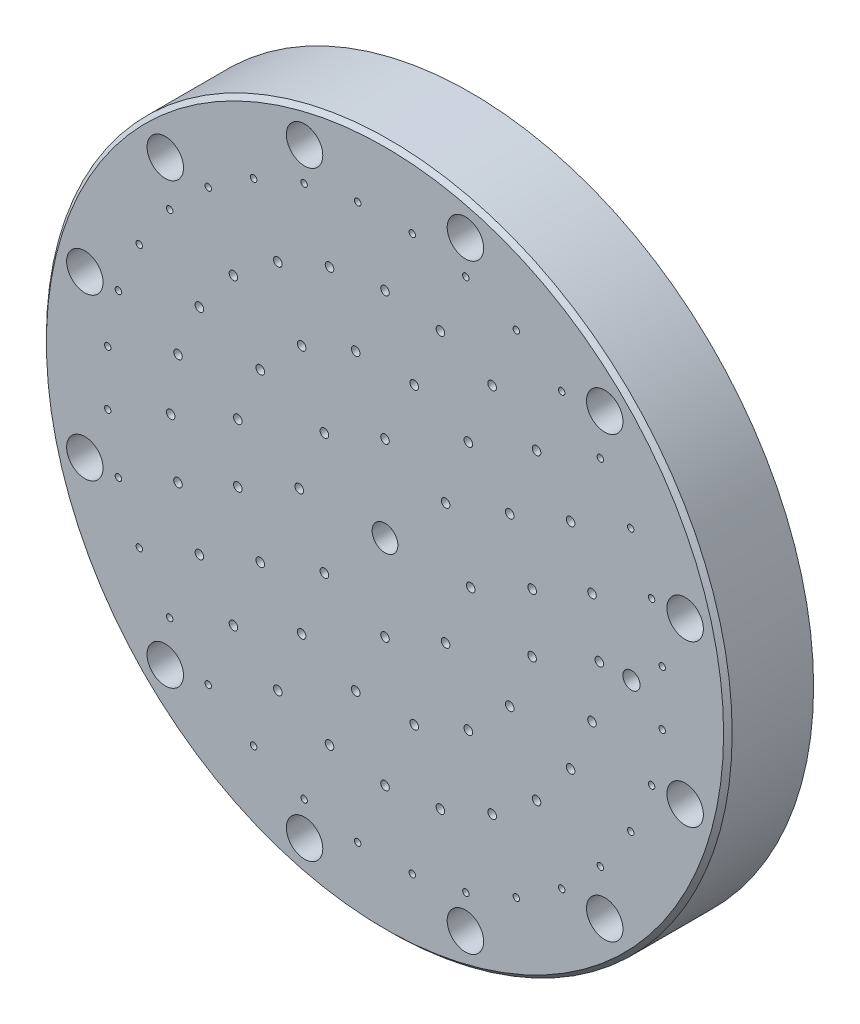
from build123d import *

# Parameters (mm, degrees)
SKETCH_1_R           = 80
EXTRUDE_1_DEPTH      = 20
SKETCH_2_R           = 23
SKETCH_2_R_2         = 17
CUT_EXTRUDE_1_DEPTH  = 8
SKETCH_3_R           = 38
SKETCH_3_R_2         = 32
CUT_EXTRUDE_2_DEPTH  = 8
SKETCH_4_R           = 53
SKETCH_4_R_2         = 47
CUT_EXTRUDE_3_DEPTH  = 8
SKETCH_5_R           = 68
SKETCH_5_R_2         = 62
CUT_EXTRUDE_4_DEPTH  = 8
SKETCH_6_R           = 1
CUT_EXTRUDE_5_DEPTH  = 12
SKETCH_7_R           = 1
CUT_EXTRUDE_6_DEPTH  = 12
SKETCH_8_R           = 1
CUT_EXTRUDE_7_DEPTH  = 12
SKETCH_9_R           = 0.75
CUT_EXTRUDE_8_DEPTH  = 12
SKETCH_10_R          = 3
CUT_EXTRUDE_9_DEPTH  = 161
SKETCH_11_R          = 2
CUT_EXTRUDE_10_DEPTH = 6
SKETCH_12_R          = 4.25
CUT_EXTRUDE_11_DEPTH = 161
CHAMFER_1_SIZE       = 1


with BuildPart() as part:
    # 草图1 → 凸台-拉伸1 (new body)
    with BuildSketch(Plane.XY):
        Circle(SKETCH_1_R)
    extrude(amount=EXTRUDE_1_DEPTH)

    # 草图2 → 切除-拉伸1 (cut)
    with BuildSketch(Plane.XY):
        Circle(SKETCH_2_R)
        Circle(SKETCH_2_R_2, mode=Mode.SUBTRACT)
    extrude(amount=CUT_EXTRUDE_1_DEPTH, mode=Mode.SUBTRACT)

    # 草图3 → 切除-拉伸2 (cut)
    with BuildSketch(Plane.XY):
        Circle(SKETCH_3_R)
        Circle(SKETCH_3_R_2, mode=Mode.SUBTRACT)
    extrude(amount=CUT_EXTRUDE_2_DEPTH, mode=Mode.SUBTRACT)

    # 草图4 → 切除-拉伸3 (cut)
    with BuildSketch(Plane.XY):
        Circle(SKETCH_4_R)
        Circle(SKETCH_4_R_2, mode=Mode.SUBTRACT)
    extrude(amount=CUT_EXTRUDE_3_DEPTH, mode=Mode.SUBTRACT)

    # 草图5 → 切除-拉伸4 (cut)
    with BuildSketch(Plane.XY):
        Circle(SKETCH_5_R)
        Circle(SKETCH_5_R_2, mode=Mode.SUBTRACT)
    extrude(amount=CUT_EXTRUDE_4_DEPTH, mode=Mode.SUBTRACT)

    # 草图6 → 切除-拉伸5 (cut)
    with BuildSketch(Plane.XY.offset(8)):
        with Locations((20, 0)):
            Circle(SKETCH_6_R)
        with Locations((14.142136, 14.142136)):
            Circle(SKETCH_6_R)
        with Locations((0, 20)):
            Circle(SKETCH_6_R)
        with Locations((-14.142136, 14.142136)):
            Circle(SKETCH_6_R)
        with Locations((-20, 0)):
            Circle(SKETCH_6_R)
        with Locations((-14.142136, -14.142136)):
            Circle(SKETCH_6_R)
        with Locations((0, -20)):
            Circle(SKETCH_6_R)
        with Locations((14.142136, -14.142136)):
            Circle(SKETCH_6_R)
    extrude(amount=CUT_EXTRUDE_5_DEPTH, mode=Mode.SUBTRACT)

    # 草图7 → 切除-拉伸6 (cut)
    with BuildSketch(Plane.XY.offset(8)):
        with Locations((34.327485, 6.828161)):
            Circle(SKETCH_7_R)
        with Locations((29.101436, 19.444958)):
            Circle(SKETCH_7_R)
        with Locations((19.444958, 29.101436)):
            Circle(SKETCH_7_R)
        with Locations((6.828161, 34.327485)):
            Circle(SKETCH_7_R)
        with Locations((-6.828161, 34.327485)):
            Circle(SKETCH_7_R)
        with Locations((-19.444958, 29.101436)):
            Circle(SKETCH_7_R)
        with Locations((-29.101436, 19.444958)):
            Circle(SKETCH_7_R)
        with Locations((-34.327485, 6.828161)):
            Circle(SKETCH_7_R)
        with Locations((-34.327485, -6.828161)):
            Circle(SKETCH_7_R)
        with Locations((-29.101436, -19.444958)):
            Circle(SKETCH_7_R)
        with Locations((-19.444958, -29.101436)):
            Circle(SKETCH_7_R)
        with Locations((-6.828161, -34.327485)):
            Circle(SKETCH_7_R)
        with Locations((6.828161, -34.327485)):
            Circle(SKETCH_7_R)
        with Locations((19.444958, -29.101436)):
            Circle(SKETCH_7_R)
        with Locations((29.101436, -19.444958)):
            Circle(SKETCH_7_R)
        with Locations((34.327485, -6.828161)):
            Circle(SKETCH_7_R)
    extrude(amount=CUT_EXTRUDE_6_DEPTH, mode=Mode.SUBTRACT)

    # 草图8 → 切除-拉伸7 (cut)
    with BuildSketch(Plane.XY.offset(8)):
        with Locations((50, 0)):
            Circle(SKETCH_8_R)
        with Locations((48.296291, 12.940952)):
            Circle(SKETCH_8_R)
        with Locations((43.30127, 25)):
            Circle(SKETCH_8_R)
        with Locations((35.355339, 35.355339)):
            Circle(SKETCH_8_R)
        with Locations((25, 43.30127)):
            Circle(SKETCH_8_R)
        with Locations((12.940952, 48.296291)):
            Circle(SKETCH_8_R)
        with Locations((0, 50)):
            Circle(SKETCH_8_R)
        with Locations((-12.940952, 48.296291)):
            Circle(SKETCH_8_R)
        with Locations((-25, 43.30127)):
            Circle(SKETCH_8_R)
        with Locations((-35.355339, 35.355339)):
            Circle(SKETCH_8_R)
        with Locations((-43.30127, 25)):
            Circle(SKETCH_8_R)
        with Locations((-48.296291, 12.940952)):
            Circle(SKETCH_8_R)
        with Locations((-50, 0)):
            Circle(SKETCH_8_R)
        with Locations((-48.296291, -12.940952)):
            Circle(SKETCH_8_R)
        with Locations((-43.30127, -25)):
            Circle(SKETCH_8_R)
        with Locations((-35.355339, -35.355339)):
            Circle(SKETCH_8_R)
        with Locations((-25, -43.30127)):
            Circle(SKETCH_8_R)
        with Locations((-12.940952, -48.296291)):
            Circle(SKETCH_8_R)
        with Locations((0, -50)):
            Circle(SKETCH_8_R)
        with Locations((12.940952, -48.296291)):
            Circle(SKETCH_8_R)
        with Locations((25, -43.30127)):
            Circle(SKETCH_8_R)
        with Locations((35.355339, -35.355339)):
            Circle(SKETCH_8_R)
        with Locations((43.30127, -25)):
            Circle(SKETCH_8_R)
        with Locations((48.296291, -12.940952)):
            Circle(SKETCH_8_R)
    extrude(amount=CUT_EXTRUDE_7_DEPTH, mode=Mode.SUBTRACT)

    # 草图9 → 切除-拉伸8 (cut)
    with BuildSketch(Plane.XY.offset(8)):
        with Locations((64.687007, 6.371114)):
            Circle(SKETCH_9_R)
        with Locations((62.201122, 18.868504)):
            Circle(SKETCH_9_R)
        with Locations((57.324882, 30.640788)):
            Circle(SKETCH_9_R)
        with Locations((50.245679, 41.235563)):
            Circle(SKETCH_9_R)
        with Locations((41.235563, 50.245679)):
            Circle(SKETCH_9_R)
        with Locations((30.640788, 57.324882)):
            Circle(SKETCH_9_R)
        with Locations((18.868504, 62.201122)):
            Circle(SKETCH_9_R)
        with Locations((6.371114, 64.687007)):
            Circle(SKETCH_9_R)
        with Locations((-6.371114, 64.687007)):
            Circle(SKETCH_9_R)
        with Locations((-18.868504, 62.201122)):
            Circle(SKETCH_9_R)
        with Locations((-30.640788, 57.324882)):
            Circle(SKETCH_9_R)
        with Locations((-41.235563, 50.245679)):
            Circle(SKETCH_9_R)
        with Locations((-50.245679, 41.235563)):
            Circle(SKETCH_9_R)
        with Locations((-57.324882, 30.640788)):
            Circle(SKETCH_9_R)
        with Locations((-62.201122, 18.868504)):
            Circle(SKETCH_9_R)
        with Locations((-64.687007, 6.371114)):
            Circle(SKETCH_9_R)
        with Locations((-64.687007, -6.371114)):
            Circle(SKETCH_9_R)
        with Locations((-62.201122, -18.868504)):
            Circle(SKETCH_9_R)
        with Locations((-57.324882, -30.640788)):
            Circle(SKETCH_9_R)
        with Locations((-50.245679, -41.235563)):
            Circle(SKETCH_9_R)
        with Locations((-41.235563, -50.245679)):
            Circle(SKETCH_9_R)
        with Locations((-30.640788, -57.324882)):
            Circle(SKETCH_9_R)
        with Locations((-18.868504, -62.201122)):
            Circle(SKETCH_9_R)
        with Locations((-6.371114, -64.687007)):
            Circle(SKETCH_9_R)
        with Locations((6.371114, -64.687007)):
            Circle(SKETCH_9_R)
        with Locations((18.868504, -62.201122)):
            Circle(SKETCH_9_R)
        with Locations((30.640788, -57.324882)):
            Circle(SKETCH_9_R)
        with Locations((41.235563, -50.245679)):
            Circle(SKETCH_9_R)
        with Locations((50.245679, -41.235563)):
            Circle(SKETCH_9_R)
        with Locations((57.324882, -30.640788)):
            Circle(SKETCH_9_R)
        with Locations((62.201122, -18.868504)):
            Circle(SKETCH_9_R)
        with Locations((64.687007, -6.371114)):
            Circle(SKETCH_9_R)
    extrude(amount=CUT_EXTRUDE_8_DEPTH, mode=Mode.SUBTRACT)

    # 草图10 → 切除-拉伸9 (cut, symmetric)
    with BuildSketch(Plane.XY):
        Circle(SKETCH_10_R)
    extrude(amount=CUT_EXTRUDE_9_DEPTH, both=True, mode=Mode.SUBTRACT)

    # 草图11 → 切除-拉伸10 (cut)
    with BuildSketch(Plane.XY.offset(20)):
        with Locations((57.5, 0)):
            Circle(SKETCH_11_R)
    extrude(amount=-CUT_EXTRUDE_10_DEPTH, mode=Mode.SUBTRACT)

    # 草图12 → 切除-拉伸11 (cut, symmetric)
    with BuildSketch(Plane.XY):
        with Locations((70.029622, 18.764381)):
            Circle(SKETCH_12_R)
        with Locations((51.265242, 51.265242)):
            Circle(SKETCH_12_R)
        with Locations((18.764381, 70.029622)):
            Circle(SKETCH_12_R)
        with Locations((-18.764381, 70.029622)):
            Circle(SKETCH_12_R)
        with Locations((-51.265242, 51.265242)):
            Circle(SKETCH_12_R)
        with Locations((-70.029622, 18.764381)):
            Circle(SKETCH_12_R)
        with Locations((-70.029622, -18.764381)):
            Circle(SKETCH_12_R)
        with Locations((-51.265242, -51.265242)):
            Circle(SKETCH_12_R)
        with Locations((-18.764381, -70.029622)):
            Circle(SKETCH_12_R)
        with Locations((18.764381, -70.029622)):
            Circle(SKETCH_12_R)
        with Locations((51.265242, -51.265242)):
            Circle(SKETCH_12_R)
        with Locations((70.029622, -18.764381)):
            Circle(SKETCH_12_R)
    extrude(amount=CUT_EXTRUDE_11_DEPTH, both=True, mode=Mode.SUBTRACT)

    # 倒角1
    chamfer_1_edges = [part.edges().sort_by_distance(p)[0] for p in [
        (-80, 0, 20),
    ]]
    chamfer(chamfer_1_edges, length=CHAMFER_1_SIZE)


solid = part.part
